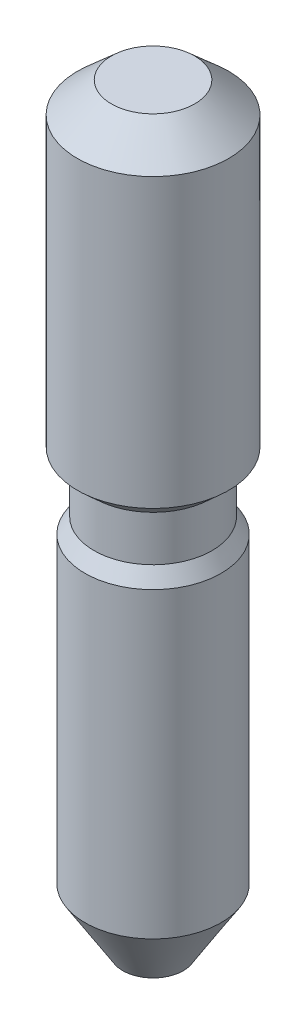
from build123d import *


with BuildPart() as part:
    # Sketch1 → Motor_reductora_husillo (revolve)
    with BuildSketch(Plane.XY, mode=Mode.PRIVATE) as motor_reductora_husillo_sk:
        Polygon((0, 0), (2.75, 0), (5, -2), (5, -21), (3.9, -22), (3.9, -25), (4.5, -26), (4.5, -46), (2, -50), (0, -50), align=None)
    revolve(motor_reductora_husillo_sk.sketch.rotate(Axis((0, -54, 0), (0, 1, 0)), 90), axis=Axis((0, -54, 0), (0, 1, 0)))


solid = part.part
